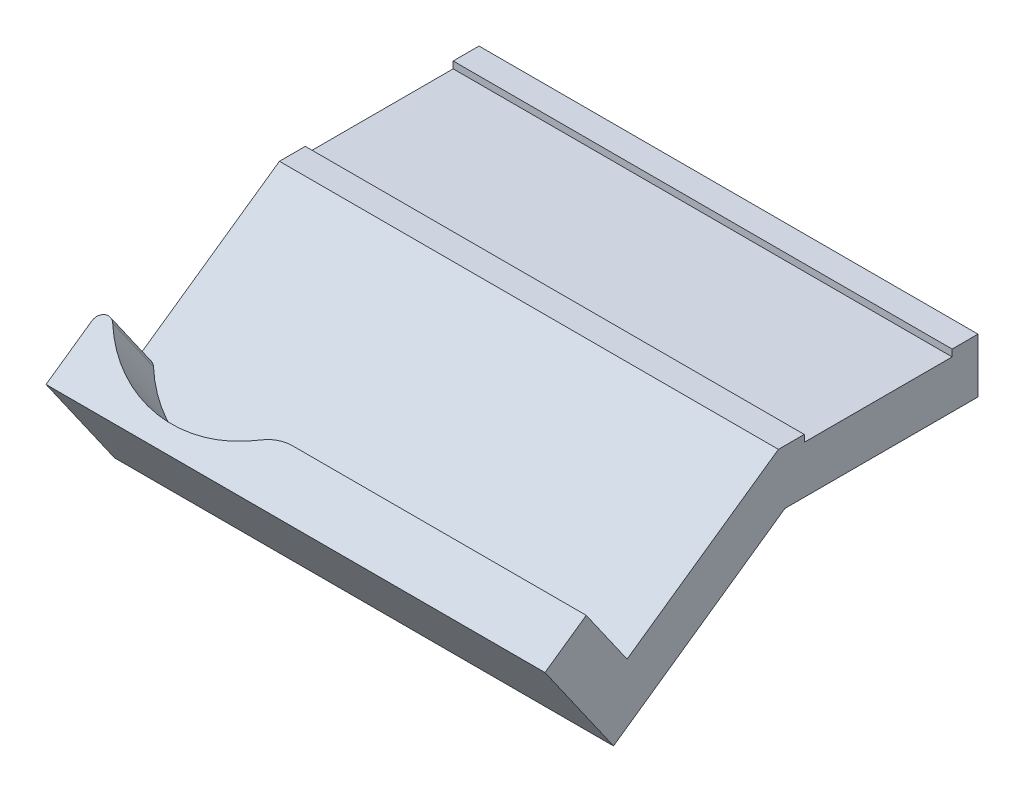
from build123d import *

# Parameters (mm, degrees)
SKETCH1_W           = 55
SKETCH1_H           = 29
BOSS_EXTRUDE1_DEPTH = 50
CUT_EXTRUDE1_DEPTH  = 50
CUT_EXTRUDE2_DEPTH  = 80.787217021
BOSS_EXTRUDE2_REACH = 81.787
SKETCH6_R           = 13.75
CUT_EXTRUDE3_DEPTH  = 79.614669909
CUT_EXTRUDE4_DEPTH  = 80.787217021
SKETCH8_R           = 6
CUT_EXTRUDE5_DEPTH  = 68.166896352
CUT_EXTRUDE6_DEPTH  = 68.166896352
SKETCH10_W          = 55
SKETCH10_H          = 4.5
CUT_EXTRUDE7_DEPTH  = 67.039564911
FILLET5_R           = 1
FILLET6_R           = 5
CUT_EXTRUDE8_DEPTH  = 65.190919401
SKETCH17_W          = 55
SKETCH17_H          = 6
BOSS_EXTRUDE4_DEPTH = 22
BOSS_EXTRUDE5_DEPTH = 55
SKETCH19_W          = 55
SKETCH19_H          = 16.3
CUT_EXTRUDE9_DEPTH  = 0.75
BOSS_EXTRUDE6_DEPTH = 55


with BuildPart() as part:
    # Sketch1 → Boss-Extrude1 (new body)
    with BuildSketch(Plane(origin=(0, 0, 0), x_dir=(1, 0, 0), z_dir=(0, 1, 0))):
        with Locations((27.5, 14.5)):
            Rectangle(SKETCH1_W, SKETCH1_H)
    extrude(amount=BOSS_EXTRUDE1_DEPTH)

    # Sketch4 → Cut-Extrude1 (cut)
    with BuildSketch(Plane(origin=(55, 0, 0), x_dir=(0, 0, -1), z_dir=(1, 0, 0))):
        Polygon((-21.678821818, 50.957602214), (19.278780397, 79.636424032), (47.957602214, 38.678821818), (7, 10), align=None)
    extrude(amount=-CUT_EXTRUDE1_DEPTH, mode=Mode.SUBTRACT)

    # Sketch5 → Cut-Extrude2 (cut, through all)
    with BuildSketch(Plane(origin=(55, 0, 0), x_dir=(0, 0, -1), z_dir=(1, 0, 0))):
        Polygon((-11.427284806, 18.88242211), (-3.235764364, 24.618186473), (2.5, 16.42666603), (-5.691520443, 10.690901667), align=None)
    extrude(amount=-CUT_EXTRUDE2_DEPTH, mode=Mode.SUBTRACT)

    # Sketch12 → Boss-Extrude2 (add, up to next)
    with BuildSketch(Plane(origin=(55, 0, 0), x_dir=(0, 0, -1), z_dir=(1, 0, 0)), mode=Mode.PRIVATE) as boss_extrude2_sk1:
        Polygon((2.5, 16.42666603), (7, 10), (7.819152044, 10.573576436), (3.319152044, 17.000242467), align=None)
    boss_extrude2_tool1 = extrude(boss_extrude2_sk1.sketch, amount=-BOSS_EXTRUDE2_REACH, mode=Mode.PRIVATE) - part.part
    add(boss_extrude2_tool1.solids().sort_by_distance((55, 13.500121, -5.159576))[0])

    # Sketch6 → Cut-Extrude3 (cut, through all)
    with BuildSketch(Plane(origin=(0, 3.421176544, 2.395533606), x_dir=(1, 0, 0), z_dir=(0, 0.8191520442889949, 0.5735764363510418))):
        with Locations((12, 22.917892202)):
            Circle(SKETCH6_R)
    extrude(amount=CUT_EXTRUDE3_DEPTH, mode=Mode.SUBTRACT)

    # Sketch7 → Cut-Extrude4 (cut, through all)
    with BuildSketch(Plane(origin=(55, 0, 0), x_dir=(0, 0, -1), z_dir=(1, 0, 0))):
        Polygon((0, 14.676147185), (6.378851002, 19.142666742), (10.878851002, 12.716000711), (85.085630618, 64.676147185), (25.408423261, 64.676147185), (0, 64.676147185), align=None)
    extrude(amount=-CUT_EXTRUDE4_DEPTH, mode=Mode.SUBTRACT)

    # Sketch8 → Cut-Extrude5 (cut, through all)
    with BuildSketch(Plane(origin=(0, 0, 0), x_dir=(1, 0, 0), z_dir=(0, 1, 0))):
        with Locations((25.75, 30.5)):
            Circle(SKETCH8_R)
    extrude(amount=CUT_EXTRUDE5_DEPTH, mode=Mode.SUBTRACT)

    # Sketch9 → Cut-Extrude6 (cut, through all)
    with BuildSketch(Plane(origin=(55, 0, 0), x_dir=(0, 0, -1), z_dir=(1, 0, 0))):
        Polygon((24.5, 22.253631919), (29, 22.253631919), (29, 25.404565841), align=None)
    extrude(amount=-CUT_EXTRUDE6_DEPTH, mode=Mode.SUBTRACT)

    # Sketch10 → Cut-Extrude7 (cut, through all)
    with BuildSketch(Plane(origin=(0, 0, 0), x_dir=(1, 0, 0), z_dir=(0, 1, 0))):
        with Locations((27.5, 26.75)):
            Rectangle(SKETCH10_W, SKETCH10_H)
    extrude(amount=CUT_EXTRUDE7_DEPTH, mode=Mode.SUBTRACT)

    # Fillet5
    fillet5_edges = [part.edges().sort_by_distance(p)[0] for p in [
        (0, 15.929333726, -8.628851002),
    ]]
    fillet(fillet5_edges, radius=FILLET5_R)

    # Fillet6
    fillet6_edges = [part.edges().sort_by_distance(p)[0] for p in [
        (20.938706199, 13.786909452, -5.569152044),
    ]]
    fillet(fillet6_edges, radius=FILLET6_R)

    # Sketch16 → Cut-Extrude8 (cut, through all)
    with BuildSketch(Plane(origin=(55, 0, 0), x_dir=(0, 0, -1), z_dir=(1, 0, 0))):
        Polygon((24.5, 15.753631919), (7.554001018, 3.887915689), (0, 14.676147185), (0, 0), (24.5, 0), align=None)
    extrude(amount=-CUT_EXTRUDE8_DEPTH, mode=Mode.SUBTRACT)

    # Sketch17 → Boss-Extrude4 (add)
    with BuildSketch(Plane(origin=(0, 0, -24.5), x_dir=(-1, 0, 0), z_dir=(0, 0, -1))):
        with Locations((-27.5, 19.253631919)):
            Rectangle(SKETCH17_W, SKETCH17_H)
    extrude(amount=BOSS_EXTRUDE4_DEPTH)

    # Sketch18 → Boss-Extrude5 (add)
    with BuildSketch(Plane(origin=(55, 0, 0), x_dir=(0, 0, -1), z_dir=(1, 0, 0))):
        Polygon((16.027000509, 9.820773804), (33.782962044, 22.253631919), (24.5, 22.253631919), (12.972999491, 14.182339269), align=None)
    extrude(amount=-BOSS_EXTRUDE5_DEPTH)

    # Sketch19 → Cut-Extrude9 (cut)
    with BuildSketch(Plane(origin=(0, 22.253631919, 0), x_dir=(1, 0, 0), z_dir=(0, 1, 0))):
        with Locations((27.5, 35.5)):
            Rectangle(SKETCH19_W, SKETCH19_H)
    extrude(amount=-CUT_EXTRUDE9_DEPTH, mode=Mode.SUBTRACT)

    # Sketch20 → Boss-Extrude6 (add)
    with BuildSketch(Plane(origin=(55, 0, 0), x_dir=(0, 0, -1), z_dir=(1, 0, 0))):
        Polygon((0, 14.676147185), (-1.228728066, 13.81578253), (6.325272951, 3.027551034), (7.554001018, 3.887915689), align=None)
    extrude(amount=-BOSS_EXTRUDE6_DEPTH)


solid = part.part
